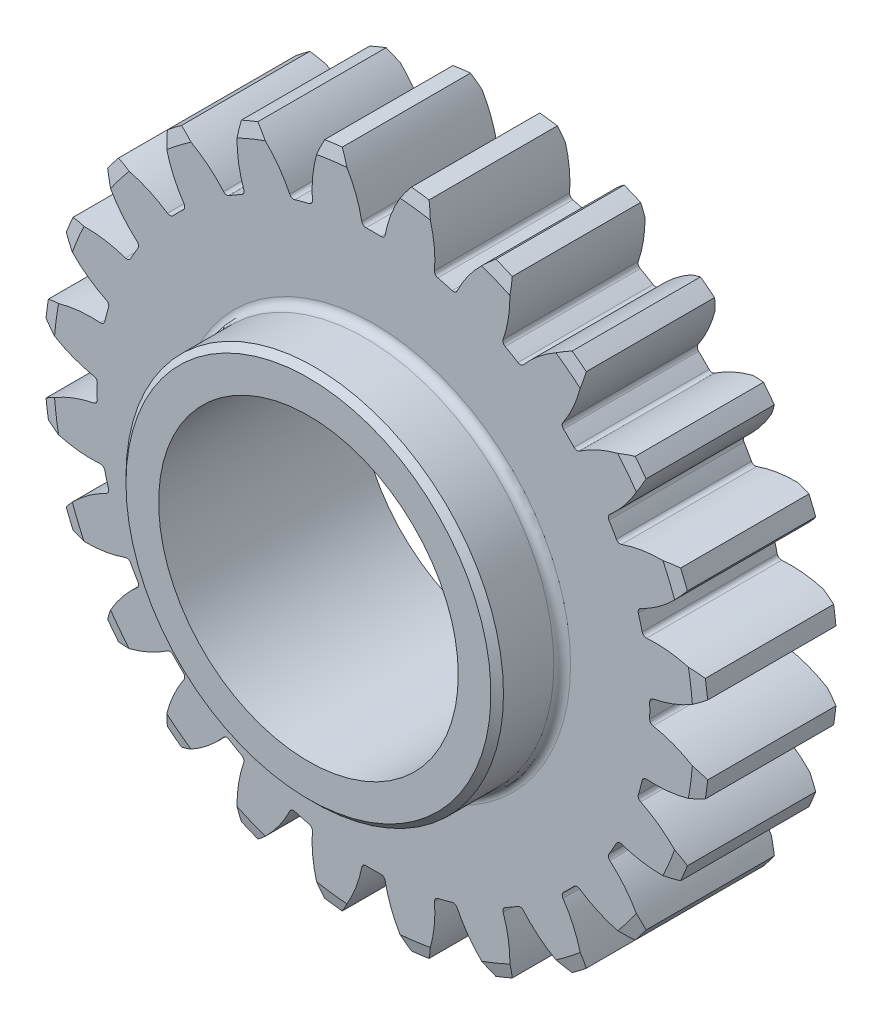
from build123d import *

# Parameters (mm, degrees)
CHANFRO1_SIZE              = 3
CHANFRO1_SIZE2             = 0.803847577
CHANFRO2_SIZE              = 3
CHANFRO2_SIZE2             = 0.803847577
CORTE_EXTRUS_O1_DEPTH      = 117.665375978
PADR_OCIRCULAR1_COUNT      = 24
ESBO_O5_R                  = 35
CORTE_EXTRUS_O3_DEPTH      = 25
CHANFRO3_SIZE              = 1.5
FILETE2_R                  = 2
ESCALA1_SCALE              = 0.7
CORTE_EXTRUS_O4_DEPTH      = 81.005647669
CORTE_EXTRUS_O4_DEPTH_BACK = 81.005647669
ESBO_O6_R                  = 25


with BuildPart() as part:
    # Esboço2 → Revolução1 (revolve)
    with BuildSketch(Plane(origin=(0, 0, 0), x_dir=(0, 0, -1), z_dir=(1, 0, 0)), mode=Mode.PRIVATE) as revolu_o1_sk:
        Polygon((-31.6, 0), (16.1, 0), (16.1, 79.29051), (-16.1, 79.29051), (-16.1, 45), (-31.6, 45), align=None)
    revolve(revolu_o1_sk.sketch.rotate(Axis((0, 0, 1000), (0, 0, -1)), 90), axis=Axis((0, 0, 1000), (0, 0, -1)))

    # Chanfro1
    chanfro1_edges = [part.edges().sort_by_distance(p)[0] for p in [
        (-79.29051, 0, 16.1),
    ]]
    chanfro1_side = [part.faces().sort_by_distance(p)[0] for p in [
        (-77.047835708, 0, 16.1),
    ]]
    chamfer(chanfro1_edges, length=CHANFRO1_SIZE, length2=CHANFRO1_SIZE2, reference=chanfro1_side[0])

    # Chanfro2
    chanfro2_edges = [part.edges().sort_by_distance(p)[0] for p in [
        (-79.29051, 0, -16.1),
    ]]
    chanfro2_side = [part.faces().sort_by_distance(p)[0] for p in [
        (0, 0, -16.1),
    ]]
    chamfer(chanfro2_edges, length=CHANFRO2_SIZE, length2=CHANFRO2_SIZE2, reference=chanfro2_side[0])

    # Esboço3 → Corte-extrusão1 (cut, through all)
    with BuildSketch(Plane.XY.offset(16.1)):
        with BuildLine():
            ThreePointArc((1.762888808, 65.848522302), (0, 65.872116), (-1.762888808, 65.848522302))
            ThreePointArc((-1.762888808, 65.848522302), (-2.426643807, 66.072132744), (-2.788207267, 66.672002891))
            ThreePointArc((-2.788207267, 66.672002891), (-3.607503812, 69.910358736), (-4.790355456, 73.034307742))
            ThreePointArc((-4.790355456, 73.034307742), (-6.347730943, 76.047765099), (-8.243218591, 78.860854188))
            ThreePointArc((-8.243218591, 78.860854188), (0, 79.29051), (8.243218591, 78.860854188))
            ThreePointArc((8.243218591, 78.860854188), (6.347730943, 76.047765099), (4.790355456, 73.034307742))
            ThreePointArc((4.790355456, 73.034307742), (3.607503812, 69.910358736), (2.788207267, 66.672002891))
            ThreePointArc((2.788207267, 66.672002891), (2.426643807, 66.072132744), (1.762888808, 65.848522302))
        make_face()
    corte_extrus_o1 = extrude(amount=-CORTE_EXTRUS_O1_DEPTH, mode=Mode.SUBTRACT)

    # PadrãoCircular1: Corte-extrusão1 ×24 about axis
    padr_ocircular1_axis = Axis((0, 0, 0), (0, 0, 1))
    for i in range(1, PADR_OCIRCULAR1_COUNT):
        add(corte_extrus_o1.rotate(padr_ocircular1_axis, i * 360 / PADR_OCIRCULAR1_COUNT), mode=Mode.SUBTRACT)

    # Esboço5 → Corte-extrusão3 (cut)
    with BuildSketch(Plane.XY.offset(31.6)):
        Circle(ESBO_O5_R)
    extrude(amount=-CORTE_EXTRUS_O3_DEPTH, mode=Mode.SUBTRACT)

    # Chanfro3
    chanfro3_edges = [part.edges().sort_by_distance(p)[0] for p in [
        (-45, 0, 31.6),
    ]]
    chamfer(chanfro3_edges, length=CHANFRO3_SIZE)

    # Filete2
    filete2_edges = [part.edges().sort_by_distance(p)[0] for p in [
        (-45, 0, 16.1),
    ]]
    fillet(filete2_edges, radius=FILETE2_R)


with BuildPart() as part_1:
    # Escala1: scaled about (0, 0, 0.94517731)
    add(part.part.scale(ESCALA1_SCALE).moved(Location((0, 0, 0.283553193))))

    # Esboço6 → Corte-extrusão4 (cut, two sides: drawn at the far end of the back side and taken through both)
    with BuildSketch(Plane.XY.offset(4.903553193).offset(-CORTE_EXTRUS_O4_DEPTH_BACK)):
        Circle(ESBO_O6_R)
    extrude(amount=CORTE_EXTRUS_O4_DEPTH + CORTE_EXTRUS_O4_DEPTH_BACK, mode=Mode.SUBTRACT)


solid = part_1.part
